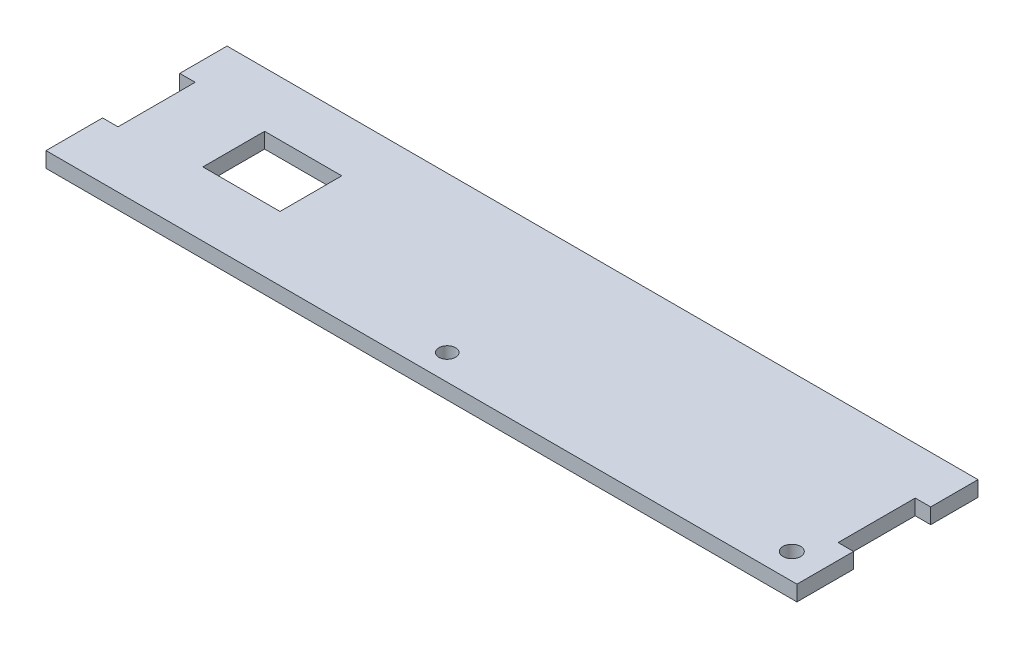
from build123d import *

# Parameters (mm, degrees)
SKETCH1_W           = 146
SKETCH1_H           = 61
BOSS_EXTRUDE1_DEPTH = 3
SKETCH2_R           = 1.621357424
SKETCH2_R_2         = 1.718635432
SKETCH2_W           = 3
SKETCH2_H           = 15
SKETCH2_W_2         = 15
SKETCH2_H_2         = 12
SKETCH2_W_3         = 30
SKETCH2_H_3         = 3
CUT_EXTRUDE1_DEPTH  = 10
SKETCH3_W           = 146
SKETCH3_H           = 25.8
CUT_EXTRUDE2_DEPTH  = 10


with BuildPart() as part:
    # Sketch1 → Boss-Extrude1 (new body)
    with BuildSketch(Plane(origin=(0, 0, 0), x_dir=(1, 0, 0), z_dir=(0, 1, 0))):
        Rectangle(SKETCH1_W, SKETCH1_H)
    extrude(amount=BOSS_EXTRUDE1_DEPTH)

    # Sketch2 → Cut-Extrude1 (cut)
    with BuildSketch(Plane(origin=(0, 3, 0), x_dir=(1, 0, 0), z_dir=(0, 1, 0))):
        with Locations(Location((0, -25.5, 0), (0, 0, 270))):
            Circle(SKETCH2_R)
        with Locations(Location((67, -25.5, 0), (0, 0, 270))):
            Circle(SKETCH2_R_2)
        with Locations((-71.5, -12)):
            Rectangle(SKETCH2_W, SKETCH2_H)
        with Locations((71.5, 13)):
            Rectangle(SKETCH2_W, SKETCH2_H)
        with Locations((71.5, -12)):
            Rectangle(SKETCH2_W, SKETCH2_H)
        with Locations((-71.5, 13)):
            Rectangle(SKETCH2_W, SKETCH2_H)
        with Locations((-47.5, -12)):
            Rectangle(SKETCH2_W_2, SKETCH2_H_2)
        with Locations((-28, 29)):
            Rectangle(SKETCH2_W_3, SKETCH2_H_3)
        with Locations((28, 29)):
            Rectangle(SKETCH2_W_3, SKETCH2_H_3)
    extrude(amount=-CUT_EXTRUDE1_DEPTH, mode=Mode.SUBTRACT)

    # Sketch3 → Cut-Extrude2 (cut)
    with BuildSketch(Plane(origin=(0, 3, 0), x_dir=(1, 0, 0), z_dir=(0, 1, 0))):
        with Locations((0, 17.6)):
            Rectangle(SKETCH3_W, SKETCH3_H)
    extrude(amount=-CUT_EXTRUDE2_DEPTH, mode=Mode.SUBTRACT)


solid = part.part
